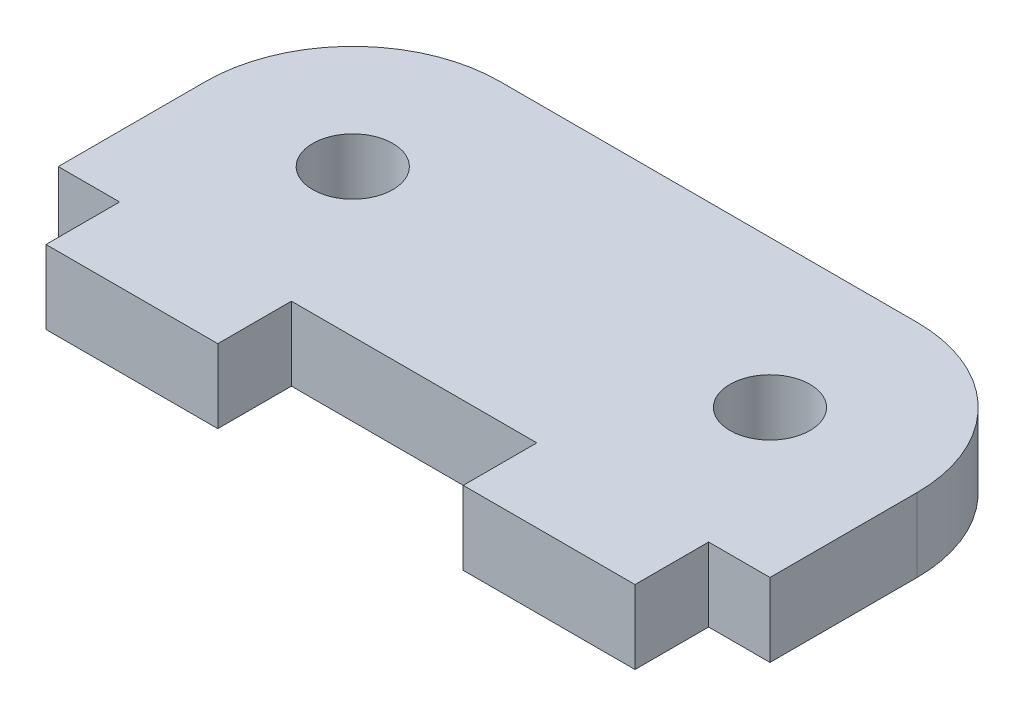
from build123d import *

# Parameters (mm, degrees)
SKETCH1_W             = 7
SKETCH1_H             = 3
BOSS_EXTRUDE1_DEPTH   = 3
F_4_CLEARANCE_HOLE1_D = 3.2639


with BuildPart() as part:
    # Sketch1 → Boss-Extrude1 (new body)
    with BuildSketch(Plane(origin=(0, 0, 0), x_dir=(1, 0, 0), z_dir=(0, 1, 0))):
        with Locations((3.5, 1.5)):
            Rectangle(SKETCH1_W, SKETCH1_H)
        with BuildLine():
            Line((-2.5, 3), (0, 3))
            Line((0, 3), (7, 3))
            Line((7, 3), (17, 3))
            Line((17, 3), (24, 3))
            Line((24, 3), (26.5, 3))
            Line((26.5, 3), (26.5, 9))
            ThreePointArc((26.5, 9), (24.742640687, 13.242640687), (20.5, 15))
            Line((20.5, 15), (3.5, 15))
            ThreePointArc((3.5, 15), (-0.742640687, 13.242640687), (-2.5, 9))
            Line((-2.5, 9), (-2.5, 3))
        make_face()
        with Locations((20.5, 1.5)):
            Rectangle(SKETCH1_W, SKETCH1_H)
    extrude(amount=BOSS_EXTRUDE1_DEPTH)

    # #4 Clearance Hole1 (through all)
    with Locations(Plane(origin=(0, 3, 0), x_dir=(1, 0, 0), z_dir=(0, 1, 0))):
        with Locations((3.5, 9), (20.5, 9)):
            Hole(F_4_CLEARANCE_HOLE1_D / 2)


solid = part.part
